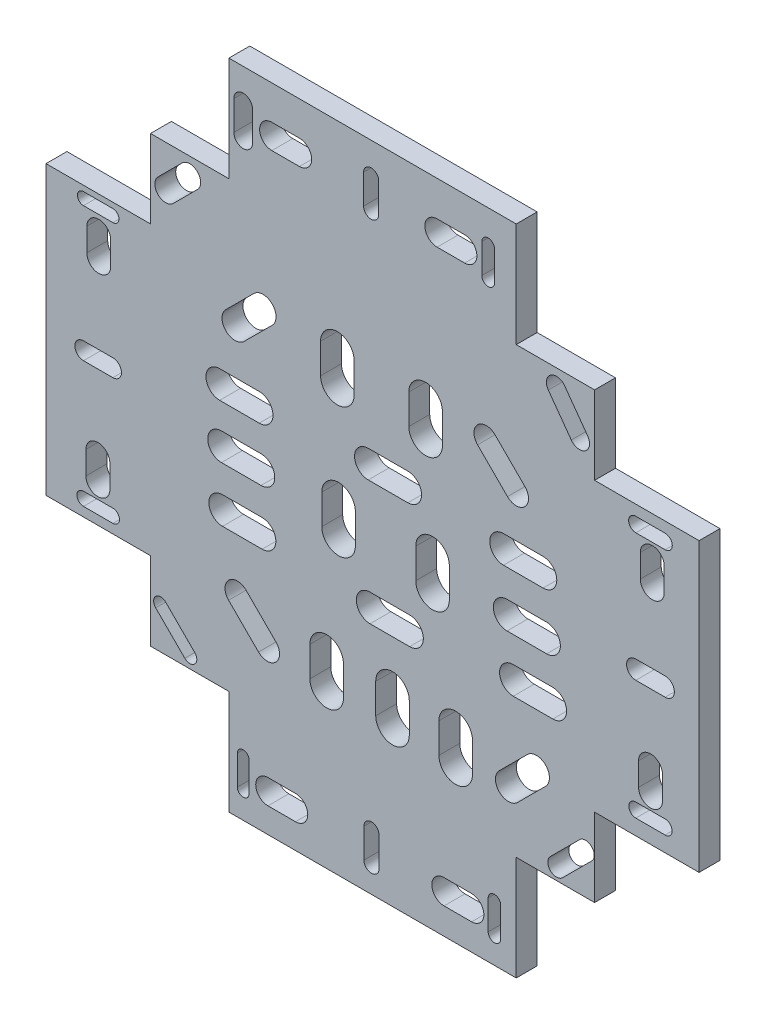
from build123d import *

# Parameters (mm, degrees)
BOSS_EXTRUDE1_DEPTH     = 4
CUT_EXTRUDE1_DEPTH      = 34
CUT_EXTRUDE1_DEPTH_BACK = 4
CUT_EXTRUDE2_DEPTH      = 24
CUT_EXTRUDE2_DEPTH_BACK = 4
CUT_EXTRUDE3_DEPTH      = 10
CUT_EXTRUDE4_DEPTH      = 10


with BuildPart() as part:
    # Sketch3 → Boss-Extrude1 (new body)
    with BuildSketch(Plane.XY):
        Polygon((0, 0), (54.996746765, 0), (54.996746765, 20.001243417), (69.997231965, 20.001243417), (69.997231965, 34.997241873), (89.996330435, 34.997241873), (89.996330435, 89.99655573), (69.997231965, 89.99655573), (69.997231965, 104.993254917), (54.996746765, 104.993254917), (54.996746765, 124.991692341), (0, 124.991692341), (0, 104.993254917), (-15.004189489, 104.993254917), (-15.004189489, 89.99655573), (-35.003049475, 89.99655573), (-35.003049475, 34.997241873), (-15.004189489, 34.997241873), (-15.004189489, 20.001243417), (0, 20.001243417), align=None)
    extrude(amount=BOSS_EXTRUDE1_DEPTH)

    # Sketch4 → Cut-Extrude1 (cut, two sides: drawn at the far end of the back side and taken through both)
    with BuildSketch(Plane(origin=(-9.796184436, 99.352259947, 0), x_dir=(1, 0, 0), z_dir=(0, 0, 1)).offset(-CUT_EXTRUDE1_DEPTH_BACK)):
        with BuildLine():
            Line((8.031031884, -26.727282303), (15.608464291, -26.727282303))
            ThreePointArc((15.608464291, -26.727282303), (18.231742798, -29.35056081), (15.608464291, -31.973839318))
            Line((15.608464291, -31.973839318), (8.031031884, -31.973839318))
            ThreePointArc((8.031031884, -31.973839318), (5.407753377, -29.35056081), (8.031031884, -26.727282303))
        make_face()
        with BuildLine():
            Line((-18.038563381, -60.071558879), (-12.412876473, -60.071558879))
            ThreePointArc((-12.412876473, -60.071558879), (-11.151946649, -61.332488704), (-12.412876473, -62.593418528))
            Line((-12.412876473, -62.593418528), (-18.038563381, -62.593418528))
            ThreePointArc((-18.038563381, -62.593418528), (-19.299493205, -61.332488704), (-18.038563381, -60.071558879))
        make_face()
        with BuildLine():
            Line((-18.038563381, -10.410322729), (-12.412876473, -10.410322729))
            ThreePointArc((-12.412876473, -10.410322729), (-11.248941251, -11.574257951), (-12.412876473, -12.738193174))
            Line((-12.412876473, -12.738193174), (-18.038563381, -12.738193174))
            ThreePointArc((-18.038563381, -12.738193174), (-19.202498603, -11.574257951), (-18.038563381, -10.410322729))
        make_face()
        with BuildLine():
            Line((-18.038563381, -35.143946202), (-12.412876473, -35.143946202))
            ThreePointArc((-12.412876473, -35.143946202), (-10.763968241, -36.792854434), (-12.412876473, -38.441762666))
            Line((-12.412876473, -38.441762666), (-18.038563381, -38.441762666))
            ThreePointArc((-18.038563381, -38.441762666), (-19.687471612, -36.792854434), (-18.038563381, -35.143946202))
        make_face()
        with BuildLine():
            Line((87.676950779, -35.029996718), (93.294980681, -35.029996718))
            ThreePointArc((93.294980681, -35.029996718), (95.057838396, -36.792854434), (93.294980681, -38.55571215))
            Line((93.294980681, -38.55571215), (87.676950779, -38.55571215))
            ThreePointArc((87.676950779, -38.55571215), (85.914093063, -36.792854434), (87.676950779, -35.029996718))
        make_face()
        with BuildLine():
            Line((87.676950779, -58.739004761), (93.294980681, -58.739004761))
            ThreePointArc((93.294980681, -58.739004761), (94.627534799, -60.071558879), (93.294980681, -61.404112998))
            Line((93.294980681, -61.404112998), (87.676950779, -61.404112998))
            ThreePointArc((87.676950779, -61.404112998), (86.34439666, -60.071558879), (87.676950779, -58.739004761))
        make_face()
        with BuildLine():
            Line((87.676950779, -11.369508031), (93.294980681, -11.369508031))
            ThreePointArc((93.294980681, -11.369508031), (94.663665823, -12.738193174), (93.294980681, -14.106878316))
            Line((93.294980681, -14.106878316), (87.676950779, -14.106878316))
            ThreePointArc((87.676950779, -14.106878316), (86.308265636, -12.738193174), (87.676950779, -11.369508031))
        make_face()
        with BuildLine():
            Line((35.637074688, -94.389417883), (35.637074688, -88.768127099))
            ThreePointArc((35.637074688, -88.768127099), (37.088171645, -87.317030142), (38.539268603, -88.768127099))
            Line((38.539268603, -88.768127099), (38.539268603, -94.389417883))
            ThreePointArc((38.539268603, -94.389417883), (37.088171645, -95.840514841), (35.637074688, -94.389417883))
        make_face()
        with BuildLine():
            Line((11.412659624, -94.389417883), (11.412659624, -88.768127099))
            ThreePointArc((11.412659624, -88.768127099), (12.532932561, -87.647854162), (13.653205498, -88.768127099))
            Line((13.653205498, -88.768127099), (13.653205498, -94.389417883))
            ThreePointArc((13.653205498, -94.389417883), (12.532932561, -95.50969082), (11.412659624, -94.389417883))
        make_face()
        with BuildLine():
            Line((59.424356932, -94.389417883), (59.424356932, -88.768127099))
            ThreePointArc((59.424356932, -88.768127099), (60.624649365, -87.567834666), (61.824941797, -88.768127099))
            Line((61.824941797, -88.768127099), (61.824941797, -94.389417883))
            ThreePointArc((61.824941797, -94.389417883), (60.624649365, -95.589710316), (59.424356932, -94.389417883))
        make_face()
        with BuildLine():
            Line((58.201066044, 13.797113761), (58.201066044, 19.410260799))
            ThreePointArc((58.201066044, 19.410260799), (59.424356932, 20.633551687), (60.647647821, 19.410260799))
            Line((60.647647821, 19.410260799), (60.647647821, 13.797113761))
            ThreePointArc((60.647647821, 13.797113761), (59.424356932, 12.573822872), (58.201066044, 13.797113761))
        make_face()
        with BuildLine():
            Line((10.744411593, 13.797113761), (10.744411593, 19.410260799))
            ThreePointArc((10.744411593, 19.410260799), (12.532932561, 21.198781767), (14.321453529, 19.410260799))
            Line((14.321453529, 19.410260799), (14.321453529, 13.797113761))
            ThreePointArc((14.321453529, 13.797113761), (12.532932561, 12.008592793), (10.744411593, 13.797113761))
        make_face()
        with BuildLine():
            Line((-2.308026774, -70.596311004), (3.26054576, -76.164883538))
            ThreePointArc((3.26054576, -76.164883538), (3.26054576, -78.06992151), (1.355507788, -78.06992151))
            Line((1.355507788, -78.06992151), (-4.213064746, -72.501348976))
            ThreePointArc((-4.213064746, -72.501348976), (-4.213064746, -70.596311004), (-2.308026774, -70.596311004))
        make_face()
        with BuildLine():
            Line((71.329017917, -75.945071464), (76.89759045, -70.376498931))
            ThreePointArc((76.89759045, -70.376498931), (79.24225257, -70.376498931), (79.24225257, -72.72116105))
            Line((79.24225257, -72.72116105), (73.673680036, -78.289733584))
            ThreePointArc((73.673680036, -78.289733584), (71.329017917, -78.289733584), (71.329017917, -75.945071464))
        make_face()
        with BuildLine():
            Line((-3.773137201, -0.842916347), (0.842916347, 3.773137201))
            ThreePointArc((0.842916347, 3.773137201), (3.773137201, 3.773137201), (3.773137201, 0.842916347))
            Line((3.773137201, 0.842916347), (-0.842916347, -3.773137201))
            ThreePointArc((-0.842916347, -3.773137201), (-3.773137201, -3.773137201), (-3.773137201, -0.842916347))
        make_face()
        with BuildLine():
            Line((74.064611694, 3.438152589), (78.460853168, -2.643011386))
            ThreePointArc((78.460853168, -2.643011386), (78.027716265, -5.336399918), (75.334327733, -4.903263016))
            Line((75.334327733, -4.903263016), (70.938086259, 1.177900959))
            ThreePointArc((70.938086259, 1.177900959), (71.371223161, 3.871289491), (74.064611694, 3.438152589))
        make_face()
        with BuildLine():
            Line((13.08087723, -60.925200922), (18.802073648, -66.646397339))
            ThreePointArc((18.802073648, -66.646397339), (18.802073648, -69.982832551), (15.465638435, -69.982832551))
            Line((15.465638435, -69.982832551), (9.744442018, -64.261636134))
            ThreePointArc((9.744442018, -64.261636134), (9.744442018, -60.925200922), (13.08087723, -60.925200922))
        make_face()
        with BuildLine():
            Line((70.423447526, -64.752805498), (65.054873257, -70.121379768))
            ThreePointArc((65.054873257, -70.121379768), (61.546342094, -70.121379768), (61.546342094, -66.612848605))
            Line((61.546342094, -66.612848605), (66.914916364, -61.244274336))
            ThreePointArc((66.914916364, -61.244274336), (70.423447526, -61.244274336), (70.423447526, -64.752805498))
        make_face()
        with BuildLine():
            Line((18.088029585, -14.494750397), (12.719455315, -19.863324667))
            ThreePointArc((12.719455315, -19.863324667), (9.210924153, -19.863324667), (9.210924153, -16.354793504))
            Line((9.210924153, -16.354793504), (14.579498422, -10.986219234))
            ThreePointArc((14.579498422, -10.986219234), (18.088029585, -10.986219234), (18.088029585, -14.494750397))
        make_face()
        with BuildLine():
            Line((60.730539398, -11.333207117), (66.451735815, -17.054403535))
            ThreePointArc((66.451735815, -17.054403535), (66.451735815, -20.390838747), (63.115300603, -20.390838747))
            Line((63.115300603, -20.390838747), (57.394104186, -14.66964233))
            ThreePointArc((57.394104186, -14.66964233), (57.394104186, -11.333207117), (60.730539398, -11.333207117))
        make_face()
        with BuildLine():
            Line((44.23521806, -18.211719271), (44.23521806, -12.490522853))
            ThreePointArc((44.23521806, -12.490522853), (47.44820659, -9.277534323), (50.66119512, -12.490522853))
            Line((50.66119512, -12.490522853), (50.66119512, -18.211719271))
            ThreePointArc((50.66119512, -18.211719271), (47.44820659, -21.424707801), (44.23521806, -18.211719271))
        make_face()
        with BuildLine():
            Line((37.898466785, -69.336694924), (37.898466785, -63.615498507))
            ThreePointArc((37.898466785, -63.615498507), (41.111455315, -60.402509977), (44.324443845, -63.615498507))
            Line((44.324443845, -63.615498507), (44.324443845, -69.336694924))
            ThreePointArc((44.324443845, -69.336694924), (41.111455315, -72.549683454), (37.898466785, -69.336694924))
        make_face()
        with BuildLine():
            Line((8.584036242, -47.342575411), (16.161468649, -47.342575411))
            ThreePointArc((16.161468649, -47.342575411), (18.784747157, -49.965853919), (16.161468649, -52.589132426))
            Line((16.161468649, -52.589132426), (8.584036242, -52.589132426))
            ThreePointArc((8.584036242, -52.589132426), (5.960757735, -49.965853919), (8.584036242, -47.342575411))
        make_face()
        with BuildLine():
            Line((64.230237612, -47.674258983), (71.807670019, -47.674258983))
            ThreePointArc((71.807670019, -47.674258983), (74.430948526, -50.297537491), (71.807670019, -52.920815998))
            Line((71.807670019, -52.920815998), (64.230237612, -52.920815998))
            ThreePointArc((64.230237612, -52.920815998), (61.606959105, -50.297537491), (64.230237612, -47.674258983))
        make_face()
        with BuildLine():
            Line((62.356930754, -26.897582926), (69.934363161, -26.897582926))
            ThreePointArc((69.934363161, -26.897582926), (72.557641669, -29.520861434), (69.934363161, -32.144139941))
            Line((69.934363161, -32.144139941), (62.356930754, -32.144139941))
            ThreePointArc((62.356930754, -32.144139941), (59.733652247, -29.520861434), (62.356930754, -26.897582926))
        make_face()
        with BuildLine():
            Line((27.339828133, -18.246507899), (27.339828133, -12.525311481))
            ThreePointArc((27.339828133, -12.525311481), (30.552816663, -9.312322951), (33.765805194, -12.525311481))
            Line((33.765805194, -12.525311481), (33.765805194, -18.246507899))
            ThreePointArc((33.765805194, -18.246507899), (30.552816663, -21.459496429), (27.339828133, -18.246507899))
        make_face()
        with BuildLine():
            Line((8.371633131, -36.876550552), (15.949065538, -36.876550552))
            ThreePointArc((15.949065538, -36.876550552), (18.572344045, -39.499829059), (15.949065538, -42.123107567))
            Line((15.949065538, -42.123107567), (8.371633131, -42.123107567))
            ThreePointArc((8.371633131, -42.123107567), (5.748354623, -39.499829059), (8.371633131, -36.876550552))
        make_face()
        with BuildLine():
            Line((63.038133248, -37.456221578), (70.615565655, -37.456221578))
            ThreePointArc((70.615565655, -37.456221578), (73.238844162, -40.079500086), (70.615565655, -42.702778593))
            Line((70.615565655, -42.702778593), (63.038133248, -42.702778593))
            ThreePointArc((63.038133248, -42.702778593), (60.414854741, -40.079500086), (63.038133248, -37.456221578))
        make_face()
        with BuildLine():
            Line((25.296220652, -69.506995548), (25.296220652, -63.78579913))
            ThreePointArc((25.296220652, -63.78579913), (28.509209182, -60.5728106), (31.722197712, -63.78579913))
            Line((31.722197712, -63.78579913), (31.722197712, -69.506995548))
            ThreePointArc((31.722197712, -69.506995548), (28.509209182, -72.719984078), (25.296220652, -69.506995548))
        make_face()
        with BuildLine():
            Line((49.989811048, -69.847596795), (49.989811048, -64.126400377))
            ThreePointArc((49.989811048, -64.126400377), (53.202799578, -60.913411847), (56.415788108, -64.126400377))
            Line((56.415788108, -64.126400377), (56.415788108, -69.847596795))
            ThreePointArc((56.415788108, -69.847596795), (53.202799578, -73.060585325), (49.989811048, -69.847596795))
        make_face()
        with BuildLine():
            Line((27.57676174, -43.138184881), (27.57676174, -37.416988464))
            ThreePointArc((27.57676174, -37.416988464), (30.78975027, -34.203999934), (34.002738801, -37.416988464))
            Line((34.002738801, -37.416988464), (34.002738801, -43.138184881))
            ThreePointArc((34.002738801, -43.138184881), (30.78975027, -46.351173411), (27.57676174, -43.138184881))
        make_face()
        with BuildLine():
            Line((45.561994839, -43.110398918), (45.561994839, -37.3892025))
            ThreePointArc((45.561994839, -37.3892025), (48.774983369, -34.17621397), (51.987971899, -37.3892025))
            Line((51.987971899, -37.3892025), (51.987971899, -43.110398918))
            ThreePointArc((51.987971899, -43.110398918), (48.774983369, -46.323387448), (45.561994839, -43.110398918))
        make_face()
        with BuildLine():
            Line((36.811837242, -49.377265218), (44.389269649, -49.377265218))
            ThreePointArc((44.389269649, -49.377265218), (47.012548156, -52.000543725), (44.389269649, -54.623822232))
            Line((44.389269649, -54.623822232), (36.811837242, -54.623822232))
            ThreePointArc((36.811837242, -54.623822232), (34.188558734, -52.000543725), (36.811837242, -49.377265218))
        make_face()
        with BuildLine():
            Line((36.471235995, -25.705478562), (44.048668402, -25.705478562))
            ThreePointArc((44.048668402, -25.705478562), (46.671946909, -28.32875707), (44.048668402, -30.952035577))
            Line((44.048668402, -30.952035577), (36.471235995, -30.952035577))
            ThreePointArc((36.471235995, -30.952035577), (33.847957487, -28.32875707), (36.471235995, -25.705478562))
        make_face()
    extrude(amount=CUT_EXTRUDE1_DEPTH + CUT_EXTRUDE1_DEPTH_BACK, mode=Mode.SUBTRACT)

    # Sketch5 → Cut-Extrude2 (cut, two sides: drawn at the far end of the back side and taken through both)
    with BuildSketch(Plane(origin=(27.228055917, 116.153168083, 0), x_dir=(1, 0, 0), z_dir=(0, 0, 1)).offset(-CUT_EXTRUDE2_DEPTH_BACK)):
        with BuildLine():
            Line((-1.451096958, -2.810645392), (-1.451096958, 2.810645392))
            ThreePointArc((-1.451096958, 2.810645392), (0, 4.26174235), (1.451096958, 2.810645392))
            Line((1.451096958, 2.810645392), (1.451096958, -2.810645392))
            ThreePointArc((1.451096958, -2.810645392), (0, -4.26174235), (-1.451096958, -2.810645392))
        make_face()
    extrude(amount=CUT_EXTRUDE2_DEPTH + CUT_EXTRUDE2_DEPTH_BACK, mode=Mode.SUBTRACT)

    # Sketch8 → Cut-Extrude3 (cut)
    with BuildSketch(Plane.XY.offset(4)):
        with BuildLine():
            Line((41.182526754, 9.734669247), (46.456759203, 9.734669247))
            ThreePointArc((46.456759203, 9.734669247), (48.800862514, 7.390565936), (46.456759203, 5.046462625))
            Line((46.456759203, 5.046462625), (41.182526754, 5.046462625))
            ThreePointArc((41.182526754, 5.046462625), (38.838423443, 7.390565936), (41.182526754, 9.734669247))
        make_face()
    extrude(amount=-CUT_EXTRUDE3_DEPTH, mode=Mode.SUBTRACT)

    # Sketch9 → Cut-Extrude4 (cut)
    with BuildSketch(Plane(origin=(81.038577239, 80.217477725, 4), x_dir=(1, 0, 0), z_dir=(0, 0, 1))):
        with BuildLine():
            Line((-72.814834214, 38.238160259), (-67.540601765, 38.238160259))
            ThreePointArc((-67.540601765, 38.238160259), (-65.196498454, 35.894056948), (-67.540601765, 33.549953638))
            Line((-67.540601765, 33.549953638), (-72.814834214, 33.549953638))
            ThreePointArc((-72.814834214, 33.549953638), (-75.158937525, 35.894056948), (-72.814834214, 38.238160259))
        make_face()
        with BuildLine():
            Line((-41.1860997, 38.047713466), (-35.911867251, 38.047713466))
            ThreePointArc((-35.911867251, 38.047713466), (-33.56776394, 35.703610155), (-35.911867251, 33.359506844))
            Line((-35.911867251, 33.359506844), (-41.1860997, 33.359506844))
            ThreePointArc((-41.1860997, 33.359506844), (-43.530203011, 35.703610155), (-41.1860997, 38.047713466))
        make_face()
        with BuildLine():
            Line((-73.559983425, -70.748378332), (-68.285750976, -70.748378332))
            ThreePointArc((-68.285750976, -70.748378332), (-65.941647665, -73.092481642), (-68.285750976, -75.436584953))
            Line((-68.285750976, -75.436584953), (-73.559983425, -75.436584953))
            ThreePointArc((-73.559983425, -75.436584953), (-75.904086736, -73.092481642), (-73.559983425, -70.748378332))
        make_face()
        with BuildLine():
            Line((-108.40603741, -38.171988427), (-108.40603741, -33.768169076))
            ThreePointArc((-108.40603741, -33.768169076), (-106.116051348, -31.478183014), (-103.826065286, -33.768169076))
            Line((-103.826065286, -33.768169076), (-103.826065286, -38.171988427))
            ThreePointArc((-103.826065286, -38.171988427), (-106.116051348, -40.461974489), (-108.40603741, -38.171988427))
        make_face()
        with BuildLine():
            Line((-108.235830249, -1.094261438), (-108.235830249, 3.309557913))
            ThreePointArc((-108.235830249, 3.309557913), (-105.945844186, 5.599543975), (-103.655858124, 3.309557913))
            Line((-103.655858124, 3.309557913), (-103.655858124, -1.094261438))
            ThreePointArc((-103.655858124, -1.094261438), (-105.945844186, -3.3842475), (-108.235830249, -1.094261438))
        make_face()
        with BuildLine():
            Line((-2.624382658, -36.895556488), (-2.624382658, -32.491737137))
            ThreePointArc((-2.624382658, -32.491737137), (-0.334396596, -30.201751075), (1.955589467, -32.491737137))
            Line((1.955589467, -32.491737137), (1.955589467, -36.895556488))
            ThreePointArc((1.955589467, -36.895556488), (-0.334396596, -39.18554255), (-2.624382658, -36.895556488))
        make_face()
        with BuildLine():
            Line((-2.289986062, -2.201909675), (-2.289986062, 2.201909675))
            ThreePointArc((-2.289986062, 2.201909675), (0, 4.491895738), (2.289986062, 2.201909675))
            Line((2.289986062, 2.201909675), (2.289986062, -2.201909675))
            ThreePointArc((2.289986062, -2.201909675), (0, -4.491895738), (-2.289986062, -2.201909675))
        make_face()
    extrude(amount=-CUT_EXTRUDE4_DEPTH, mode=Mode.SUBTRACT)


solid = part.part
